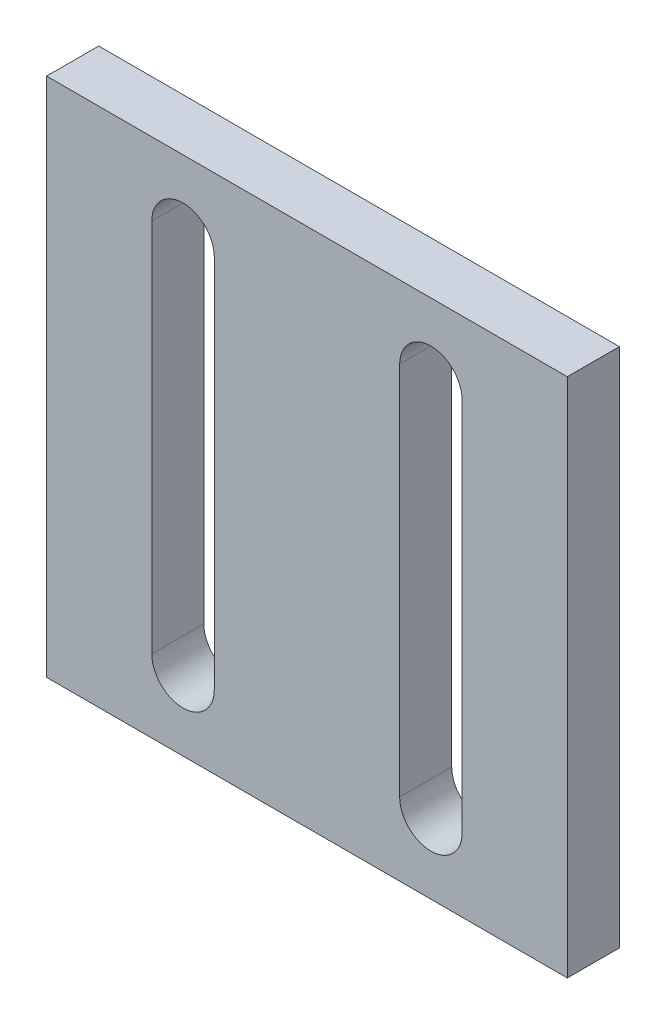
from build123d import *

# Parameters (mm, degrees)
SKETCH1_W           = 50
SKETCH1_H           = 50
BOSS_EXTRUDE1_DEPTH = 5
CUT_EXTRUDE1_DEPTH  = 71.887234394


with BuildPart() as part:
    # Sketch1 → Boss-Extrude1 (new body)
    with BuildSketch(Plane.XY):
        with Locations((25, 25)):
            Rectangle(SKETCH1_W, SKETCH1_H)
    extrude(amount=BOSS_EXTRUDE1_DEPTH)

    # Sketch2 → Cut-Extrude1 (cut, through all)
    with BuildSketch(Plane.XY.offset(5)):
        with BuildLine():
            Line((10.1, 43), (10.1, 7))
            ThreePointArc((10.1, 7), (13.1, 4), (16.1, 7))
            Line((16.1, 7), (16.1, 43))
            ThreePointArc((16.1, 43), (13.1, 46), (10.1, 43))
        make_face()
        with BuildLine():
            Line((33.9, 43), (33.9, 7))
            ThreePointArc((33.9, 7), (36.9, 4), (39.9, 7))
            Line((39.9, 7), (39.9, 43))
            ThreePointArc((39.9, 43), (36.9, 46), (33.9, 43))
        make_face()
    extrude(amount=-CUT_EXTRUDE1_DEPTH, mode=Mode.SUBTRACT)


solid = part.part
